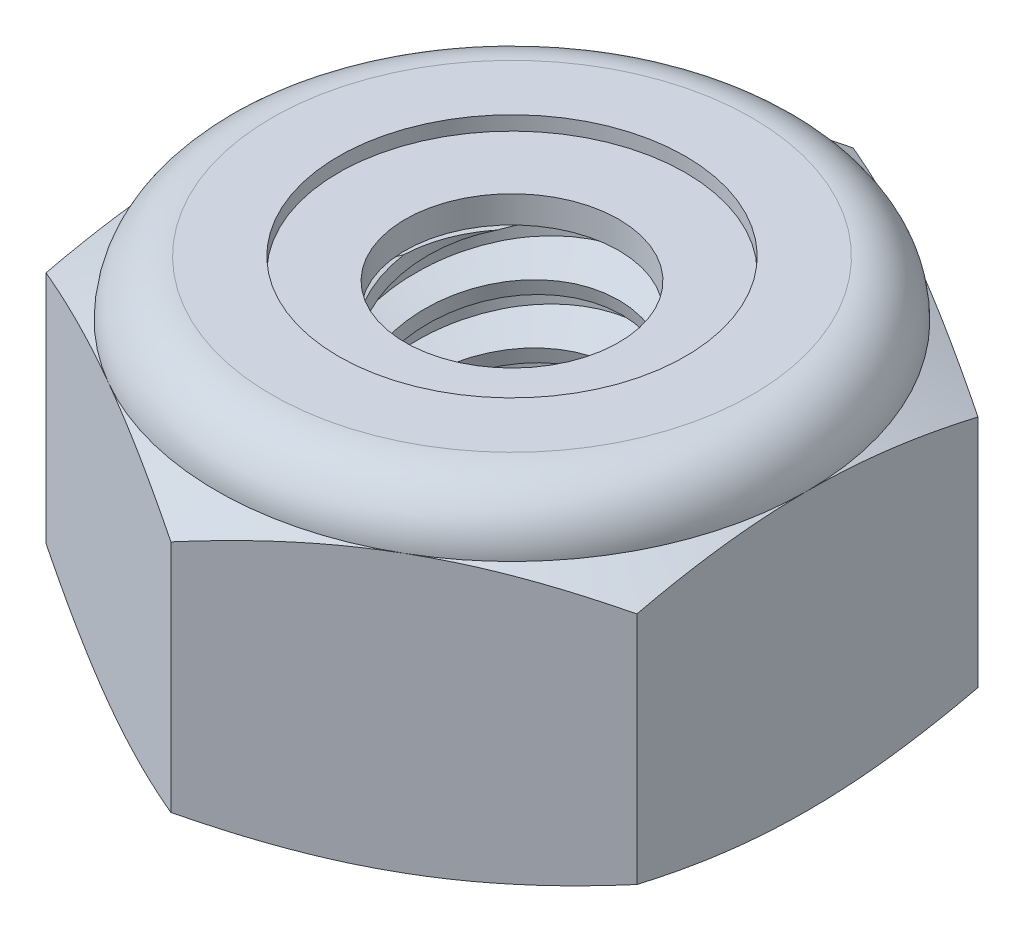
from build123d import *

# Parameters (mm, degrees)
EXTRUDE1_DEPTH      = 3.571875
SKETCH2_W           = 1.4224
SKETCH2_H           = 3.571875
LPATTERN1_COUNT     = 6
LPATTERN1_PITCH     = 0.635
LPATTERN1_COL_COUNT = 2
LPATTERN1_COL_PITCH = 0.635


with BuildPart() as part:
    # Sketch1 → Extrude1 (new body)
    with BuildSketch(Plane(origin=(0, 0, 0), x_dir=(1, 0, 0), z_dir=(0, 1, 0))):
        Polygon((0, 3.666174209), (-3.175, 1.833087105), (-3.175, -1.833087105), (0, -3.666174209), (3.175, -1.833087105), (3.175, 1.833087105), align=None)
    extrude(amount=EXTRUDE1_DEPTH)

    # Sketch4 → Cut-Revolve2 (revolve, cut)
    with BuildSketch(Plane(origin=(0, 0, 0), x_dir=(0, 0, -1), z_dir=(1, 0, 0))):
        Polygon((0, 3.571875), (1.4224, 3.571875), (1.147473684, 3.443674754), (1.147473684, 0.128200246), (1.4224, 0), (0, 0), align=None)
    revolve(axis=Axis((0, 3.571875, 0), (0, 1, 0)), mode=Mode.SUBTRACT)


with BuildPart() as body_2:
    # Sketch2 → Revolve1 (revolve)
    with BuildSketch(Plane(origin=(0, 0, 0), x_dir=(0, 0, -1), z_dir=(1, 0, 0))):
        with Locations((0.7112, 1.7859375)):
            Rectangle(SKETCH2_W, SKETCH2_H)
    revolve(axis=Axis((0, -1.4224, 0), (0, 1, 0)))

    # Sketch3 → Cut-Revolve1 (revolve, cut)
    with BuildSketch(Plane(origin=(0, 0, 0), x_dir=(0, 0, -1), z_dir=(1, 0, 0)), mode=Mode.PRIVATE) as cut_revolve1_sk:
        Polygon((1.439692084, 3.494406462), (1.560736676, 2.952126693), (1.182057853, 3.070921117), (1.147473684, 3.225858194), align=None)
    cut_revolve1 = revolve(cut_revolve1_sk.sketch.rotate(Axis((0, 3.571875, 0.152561988), (0, -0.9759815859905213, -0.21785303258717037)), 180), axis=Axis((0, 3.571875, 0.152561988), (0, -0.9759815859905213, -0.21785303258717037)), mode=Mode.SUBTRACT)

    # LPattern1: Cut-Revolve1 ×6
    with Locations(*[(0, -i * LPATTERN1_PITCH, 0) for i in range(1, LPATTERN1_COUNT)]):
        add(cut_revolve1, mode=Mode.SUBTRACT)

    # LPattern1 col: Cut-Revolve1 ×2
    with Locations(*[(0, i * LPATTERN1_COL_PITCH, 0) for i in range(1, LPATTERN1_COL_COUNT)]):
        add(cut_revolve1, mode=Mode.SUBTRACT)


with BuildPart() as part_1:
    add(part.part)

    # Combine1: cut body 2
    add(body_2.part, mode=Mode.SUBTRACT)

    # Sketch5 → Cut-Revolve3 (revolve, cut)
    with BuildSketch(Plane(origin=(0, 0, 0), x_dir=(0, 0, -1), z_dir=(1, 0, 0)), mode=Mode.PRIVATE) as cut_revolve3_sk:
        with BuildLine():
            Line((0, 0), (3.175, 0))
            Line((3.175, 0), (3.666174209, 0.229038295))
            Line((3.666174209, 0.229038295), (3.666174209, 2.747524205))
            Line((3.666174209, 2.747524205), (3.175, 2.9765625))
            ThreePointArc((3.175, 2.9765625), (3.000637006, 3.397512006), (2.5796875, 3.571875))
            Line((2.5796875, 3.571875), (2.5796875, 4.841875))
            Line((2.5796875, 4.841875), (4.936174209, 4.841875))
            Line((4.936174209, 4.841875), (4.936174209, -1.27))
            Line((4.936174209, -1.27), (0, -1.27))
            Line((0, -1.27), (0, 0))
        make_face()
    revolve(cut_revolve3_sk.sketch.rotate(Axis((0, 0, 0), (0, 1, 0)), 47.880307698), axis=Axis((0, 0, 0), (0, 1, 0)), mode=Mode.SUBTRACT)

    # Sketch6 → Cut-Revolve4 (revolve, cut)
    with BuildSketch(Plane(origin=(0, 0, 0), x_dir=(0, 0, -1), z_dir=(1, 0, 0)), mode=Mode.PRIVATE) as cut_revolve4_sk:
        with BuildLine():
            Line((0, 2.9765625), (3.0226, 2.9765625))
            ThreePointArc((3.0226, 2.9765625), (2.892873932, 3.289748932), (2.5796875, 3.419475))
            Line((2.5796875, 3.419475), (1.863580592, 3.419475))
            Line((1.863580592, 3.419475), (1.863580592, 4.841875))
            Line((1.863580592, 4.841875), (0, 4.841875))
            Line((0, 4.841875), (0, 2.9765625))
        make_face()
    revolve(cut_revolve4_sk.sketch.rotate(Axis((0, 4.841875, 0), (0, 1, 0)), 20.277821511), axis=Axis((0, 4.841875, 0), (0, 1, 0)), mode=Mode.SUBTRACT)


with BuildPart() as body_2_2:
    # Sketch7 → Revolve2 (revolve)
    with BuildSketch(Plane(origin=(0, 0, 0), x_dir=(0, 0, -1), z_dir=(1, 0, 0))):
        with BuildLine():
            Line((1.147473684, 3.0527625), (2.938395763, 3.0527625))
            ThreePointArc((2.938395763, 3.0527625), (2.810484559, 3.261537543), (2.5796875, 3.343275))
            Line((2.5796875, 3.343275), (1.147473684, 3.343275))
            Line((1.147473684, 3.343275), (1.147473684, 3.0527625))
        make_face()
    revolve(axis=Axis((0, 3.0527625, 0), (0, 1, 0)))


solid = Compound([part_1.part, body_2_2.part])
